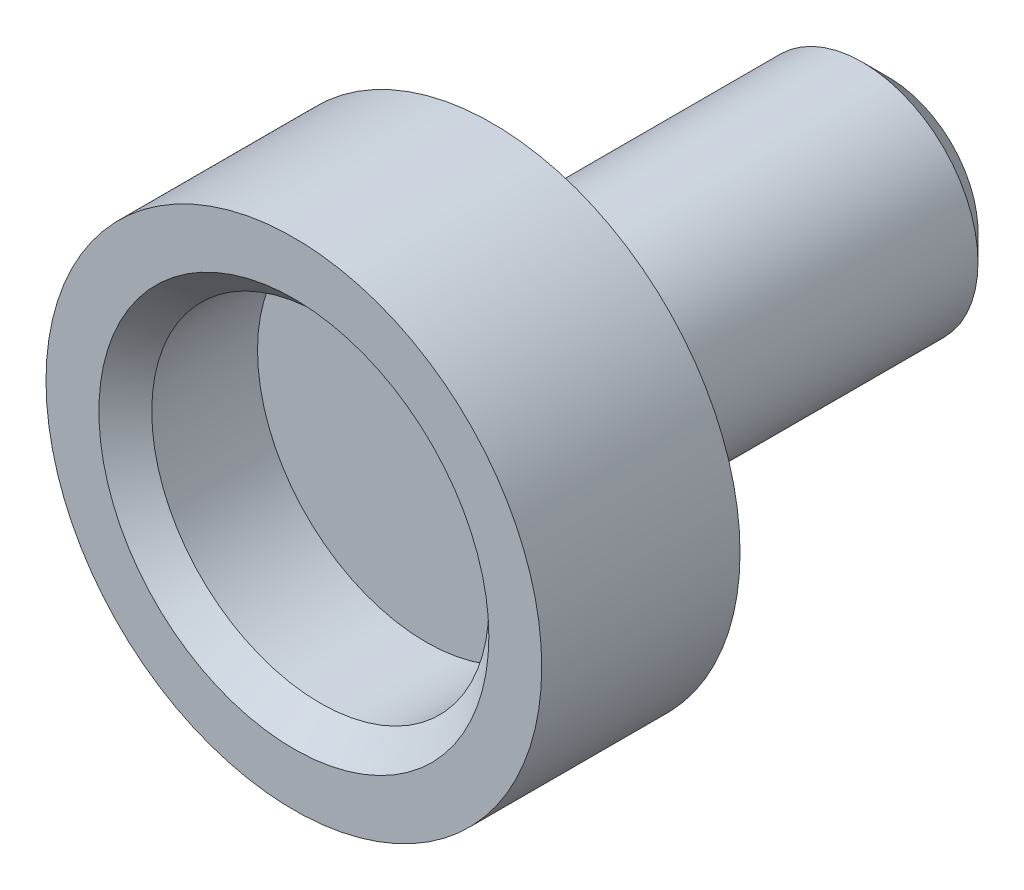
from build123d import *

# Parameters (mm, degrees)
ESQUISSE1_R        = 3.75
ESQUISSE1_R_2      = 2.55
BOSS_EXTRU_1_DEPTH = 2
BOSS_EXTRU_2_START = 1
ESQUISSE2_R        = 3.75
BOSS_EXTRU_2_DEPTH = 1
ESQUISSE3_R        = 1.75
BOSS_EXTRU_3_DEPTH = 6
CONG_1_R           = 0.6
CHANFREIN1_SIZE    = 0.4
CHANFREIN2_SIZE    = 0.4


with BuildPart() as part:
    # Esquisse1 → Boss.-Extru.1 (new body)
    with BuildSketch(Plane.XY):
        Circle(ESQUISSE1_R)
        Circle(ESQUISSE1_R_2, mode=Mode.SUBTRACT)
    extrude(amount=BOSS_EXTRU_1_DEPTH)

    # Esquisse2 → Boss.-Extru.2 (add)
    with BuildSketch(Plane(origin=(0, 0, 0), x_dir=(-1, 0, 0), z_dir=(0, 0, -1)).offset(BOSS_EXTRU_2_START)):
        Circle(ESQUISSE2_R)
    extrude(amount=-BOSS_EXTRU_2_DEPTH)

    # Esquisse3 → Boss.-Extru.3 (add)
    with BuildSketch(Plane(origin=(0, 0, -1), x_dir=(-1, 0, 0), z_dir=(0, 0, -1))):
        Circle(ESQUISSE3_R)
    extrude(amount=BOSS_EXTRU_3_DEPTH)

    # Congé1
    cong_1_edges = [part.edges().sort_by_distance(p)[0] for p in [
        (1.75, 0, -1),
    ]]
    fillet(cong_1_edges, radius=CONG_1_R)

    # Chanfrein1
    chanfrein1_edges = [part.edges().sort_by_distance(p)[0] for p in [
        (1.75, 0, -7),
    ]]
    chamfer(chanfrein1_edges, length=CHANFREIN1_SIZE)

    # Chanfrein2
    chanfrein2_edges = [part.edges().sort_by_distance(p)[0] for p in [
        (-2.55, 0, 2),
    ]]
    chamfer(chanfrein2_edges, length=CHANFREIN2_SIZE)


solid = part.part
